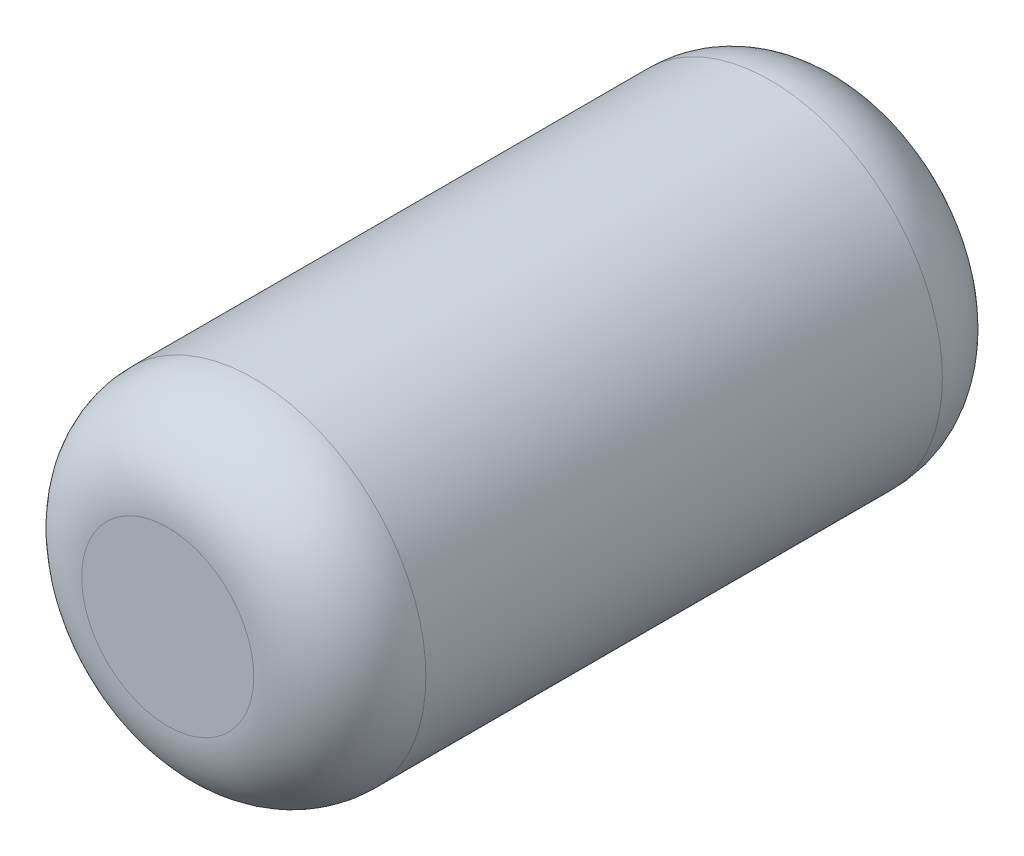
from build123d import *

# Parameters (mm, degrees)
SKETCH2_R           = 50
BOSS_EXTRUDE1_DEPTH = 100
FILLET1_R           = 25


with BuildPart() as part:
    # Sketch2 → Boss-Extrude1 (new, symmetric)
    with BuildSketch(Plane.XY):
        Circle(SKETCH2_R)
    extrude(amount=BOSS_EXTRUDE1_DEPTH, both=True)

    # Fillet1
    fillet1_edges = [part.edges().sort_by_distance(p)[0] for p in [
        (-50, 0, -100),
        (-50, 0, 100),
    ]]
    fillet(fillet1_edges, radius=FILLET1_R)


solid = part.part
